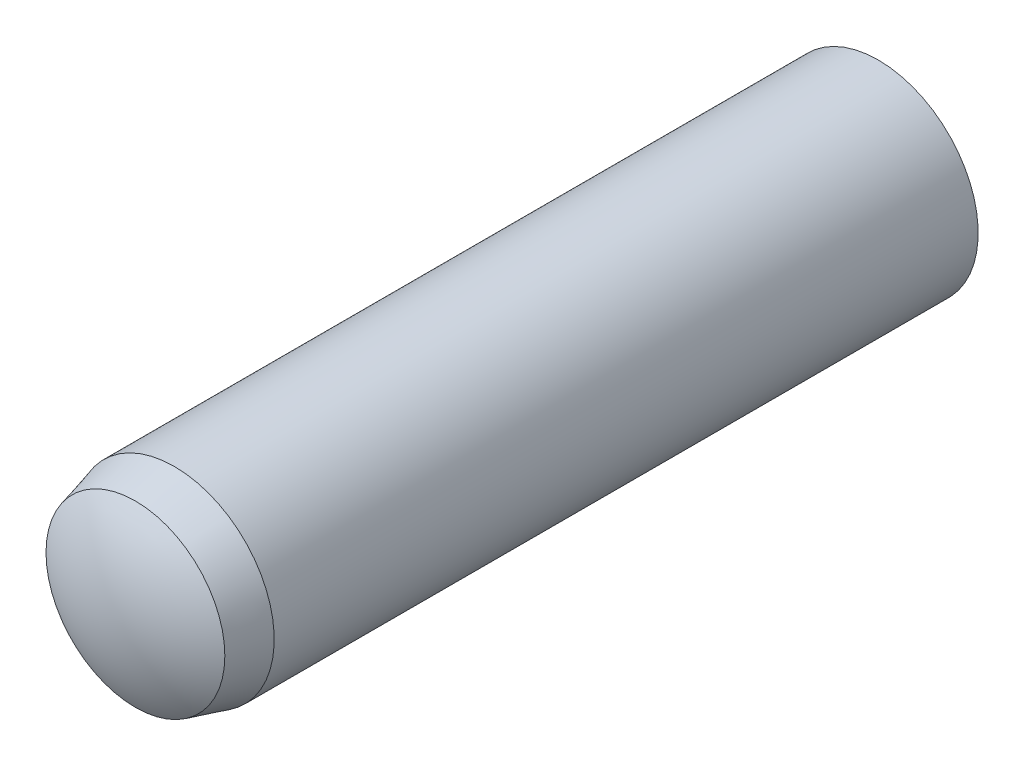
from build123d import *


with BuildPart() as part:
    # Sketch3 → Revolve1 (revolve)
    with BuildSketch(Plane(origin=(0, 0, 0), x_dir=(0, 0, -1), z_dir=(1, 0, 0)), mode=Mode.PRIVATE) as revolve1_sk:
        with BuildLine():
            Line((-6, 0), (6, 0))
            ThreePointArc((6, 0), (5.885076627, 0.783022988), (5.55, 1.5))
            Line((5.55, 1.5), (-5.025, 1.5))
            Line((-5.025, 1.5), (-5.61, 1.343249722))
            ThreePointArc((-5.61, 1.343249722), (-5.90052754, 0.699360389), (-6, 0))
        make_face()
    revolve(revolve1_sk.sketch.rotate(Axis((0, 0, 6), (0, 0, -1)), 180), axis=Axis((0, 0, 6), (0, 0, -1)))


solid = part.part
